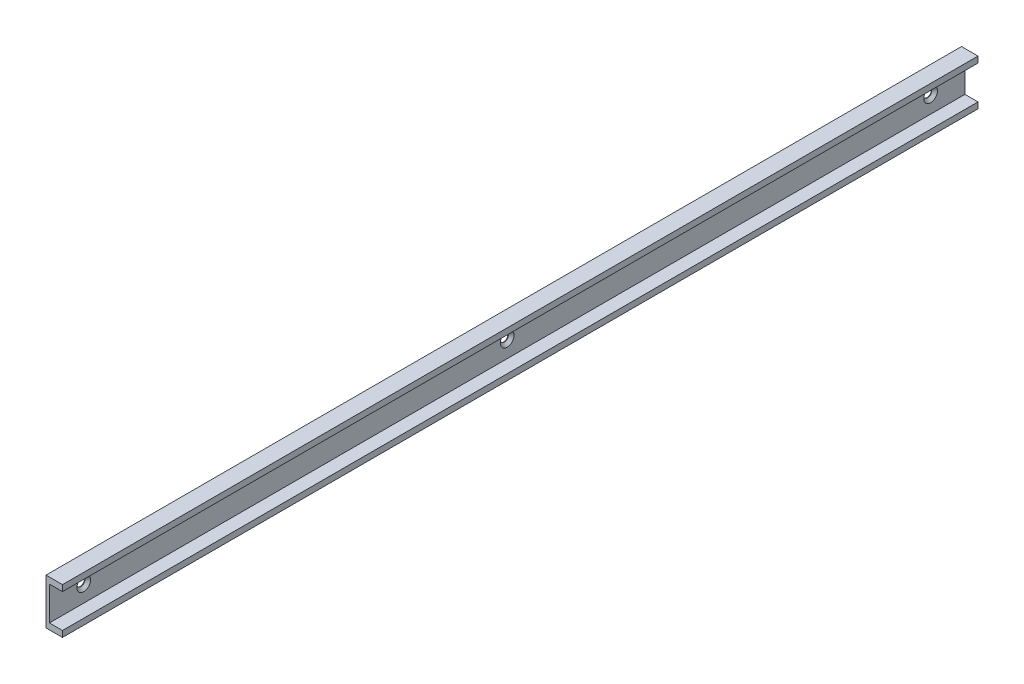
from build123d import *

# Parameters (mm, degrees)
SKETCH_1_W                 = 7.2
SKETCH_1_H                 = 20
EXTRUDE_1_DEPTH            = 200
SKETCH_2_W                 = 5.7
SKETCH_2_H                 = 14.7
CUT_EXTRUDE_1_DEPTH        = 200
PATTERN_LINEAR_1_COUNT     = 2
PATTERN_LINEAR_1_PITCH     = 185
PATTERN_LINEAR_1_COL_COUNT = 2
PATTERN_LINEAR_1_COL_PITCH = 185


with BuildPart() as part:
    # 草图1 → 凸台-拉伸1 (new, symmetric)
    with BuildSketch(Plane.XY):
        Rectangle(SKETCH_1_W, SKETCH_1_H)
    extrude(amount=EXTRUDE_1_DEPTH, both=True)

    # 草图2 → 切除-拉伸1 (cut, symmetric)
    with BuildSketch(Plane.XY):
        with Locations((0.75, 0)):
            Rectangle(SKETCH_2_W, SKETCH_2_H)
    extrude(amount=CUT_EXTRUDE_1_DEPTH, both=True, mode=Mode.SUBTRACT)

    # 草图4 → 切除-旋转1 (revolve, cut)
    with BuildSketch(Plane.XY, mode=Mode.PRIVATE) as cut_revolve_1_sk:
        Polygon((-3.6, 1.75), (-3.35, 1.75), (-2.1, 3), (-2.1, 0), (-3.6, 0), align=None)
    cut_revolve_1 = revolve(cut_revolve_1_sk.sketch.rotate(Axis((-2.1, 0, 0), (-1, 0, 0)), 90), axis=Axis((-2.1, 0, 0), (-1, 0, 0)), mode=Mode.SUBTRACT)

    # 阵列(线性)1: 切除-旋转1 ×2
    with Locations(*[(0, 0, -i * PATTERN_LINEAR_1_PITCH) for i in range(1, PATTERN_LINEAR_1_COUNT)]):
        add(cut_revolve_1, mode=Mode.SUBTRACT)

    # 阵列(线性)1 col: 切除-旋转1 ×2
    with Locations(*[(0, 0, i * PATTERN_LINEAR_1_COL_PITCH) for i in range(1, PATTERN_LINEAR_1_COL_COUNT)]):
        add(cut_revolve_1, mode=Mode.SUBTRACT)


solid = part.part
